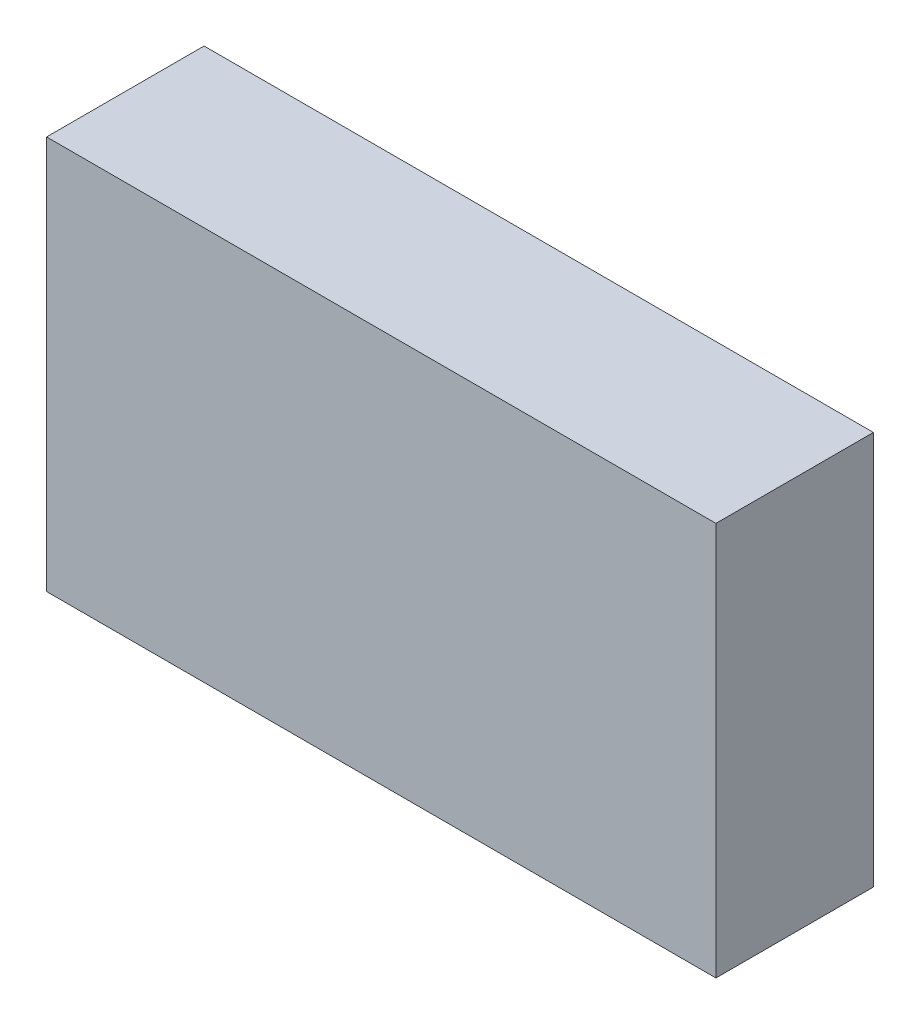
from build123d import *

# Parameters (mm, degrees)
STORE_PLC_GIRIS_MODULU_16_KANAL_1_START = -660
SKETCH1_W                               = 170
SKETCH1_H                               = 100
STORE_PLC_GIRIS_MODULU_16_KANAL_1_DEPTH = 40


with BuildPart() as part:
    # Sketch1 → STORE_PLC_giris_modulu_16_kanal_1 (new body)
    with BuildSketch(Plane.XY.offset(STORE_PLC_GIRIS_MODULU_16_KANAL_1_START)):
        with Locations((1035, 1740)):
            Rectangle(SKETCH1_W, SKETCH1_H)
    extrude(amount=-STORE_PLC_GIRIS_MODULU_16_KANAL_1_DEPTH)


solid = part.part
